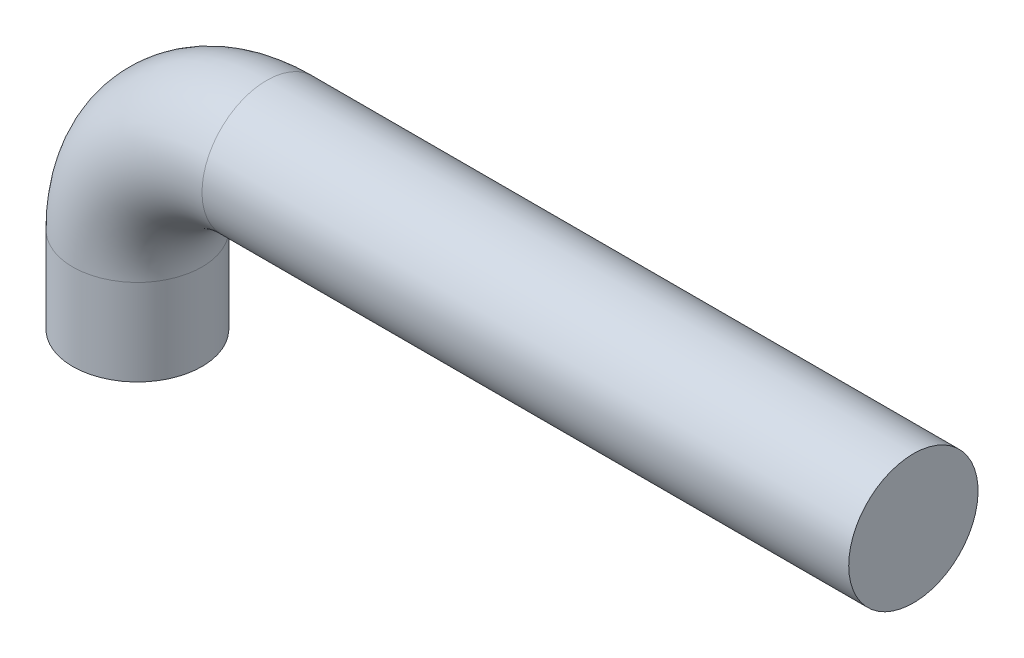
from build123d import *

# Parameters (mm, degrees)
CROQUIS3_R = 3


with BuildPart() as part:
    # Barrer1: sweep along a path in Croquis2
    with BuildLine(Plane.XY) as barrer1_path:
        Line((0, 0), (0, 4))
        ThreePointArc((0, 4), (1.757359313, 8.242640687), (6, 10))
        Line((6, 10), (36, 10))
    # Croquis3 → Barrer1 (sweep)
    with BuildSketch(Plane(origin=(0, 0, 0), x_dir=(1, 0, 0), z_dir=(0, 1, 0))):
        Circle(CROQUIS3_R)
    sweep(path=barrer1_path.line)


solid = part.part
